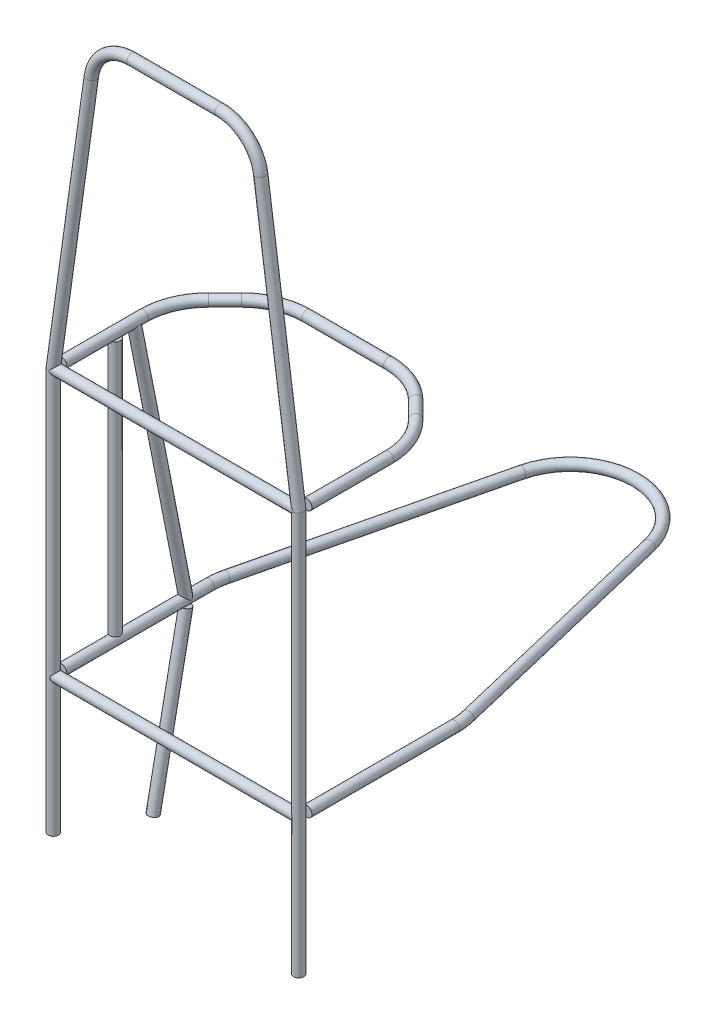
from build123d import *

# Parameters (mm, degrees)
SWEEP_1_PROFILE_R = 12.5
SWEEP_2_PROFILE_R = 12.5
SWEEP_4_PROFILE_R = 12.5
SWEEP_5_PROFILE_R = 12.5
SWEEP_6_PROFILE_R = 12.5
SWEEP_7_PROFILE_R = 12.5
SWEEP_8_PROFILE_R = 12.5
SWEEP_9_PROFILE_R = 12.5


with BuildPart() as part:
    # 扫描1: sweep along a path in 草图7
    with BuildLine(Plane(origin=(0, 0, 0), x_dir=(1, 0, 0), z_dir=(0, 1, 0))) as sweep_1_path:
        Line((-300, -380), (-300, -18.937247943))
        ThreePointArc((-300, -18.937247943), (-298.890953113, -0.131264349), (-295.579187264, 18.414010274))
        Line((-295.579187264, 18.414010274), (-155.579187264, 601.555978087))
        ThreePointArc((-155.579187264, 601.555978087), (0, 724.20471987), (155.579187264, 601.555978087))
        Line((155.579187264, 601.555978087), (295.579187264, 18.414010274))
        ThreePointArc((295.579187264, 18.414010274), (298.890953113, -0.131264349), (300, -18.937247943))
        Line((300, -18.937247943), (300, -380))
    # 扫描1 profile (on start of the path) → 扫描1 (sweep)
    with BuildSketch(Plane(origin=(-300, 0, 380), x_dir=(-1, 0, 0), z_dir=(0, 0, -1))):
        Circle(SWEEP_1_PROFILE_R)
    sweep(path=sweep_1_path.line)



with BuildPart() as body_2:
    # 扫描2: sweep along a path in 草图16
    with BuildLine(Plane(origin=(0, 650, 0), x_dir=(1, 0, 0), z_dir=(0, 1, 0))) as sweep_2_path:
        Line((-300, -380), (-300, -180))
        ThreePointArc((-300, -180), (-287.820725202, -118.770650822), (-253.13708499, -66.86291501))
        Line((-253.13708499, -66.86291501), (-213.13708499, -26.86291501))
        ThreePointArc((-213.13708499, -26.86291501), (-161.229349178, 7.820725202), (-100, 20))
        Line((-100, 20), (100, 20))
        ThreePointArc((100, 20), (161.229349178, 7.820725202), (213.13708499, -26.86291501))
        Line((213.13708499, -26.86291501), (253.13708499, -66.86291501))
        ThreePointArc((253.13708499, -66.86291501), (287.820725202, -118.770650822), (300, -180))
        Line((300, -180), (300, -380))
    # 扫描2 profile (on start of the path) → 扫描2 (sweep)
    with BuildSketch(Plane(origin=(-300, 650, 380), x_dir=(-1, 0, 0), z_dir=(0, 0, -1))):
        Circle(SWEEP_2_PROFILE_R)
    sweep(path=sweep_2_path.line)


with BuildPart() as part_1:
    add(part.part)

    add(body_2.part)  # 扫描4 merges body 2
    # 扫描4: sweep along a path in 草图62
    with BuildLine(Plane(origin=(-300, 0, 0), x_dir=(0, 0, -1), z_dir=(1, 0, 0))) as sweep_4_path:
        Line((-203.11294728, 648.324159638), (-75.515115371, 0))
    # 扫描4 profile (on start of the path) → 扫描4 (sweep)
    with BuildSketch(Plane(origin=(-300, 648.324159638, 203.11294728), x_dir=(0, 0.19310731812236004, -0.9811776412493254), z_dir=(0, -0.9811776412493254, -0.19310731812236004))):
        Circle(SWEEP_4_PROFILE_R)
    sweep(path=sweep_4_path.line)


with BuildPart() as body_2_2:
    # 扫描5: sweep along a path in 草图71
    with BuildLine(Plane.XY.offset(400)) as sweep_5_path:
        Line((-300, -334.084366165), (-300, 650))
        Line((-300, 650), (-206.993357902, 1313.874185482))
        ThreePointArc((-206.993357902, 1313.874185482), (-173.582833881, 1375.456671502), (-107.960499833, 1400))
        Line((-107.960499833, 1400), (107.960499833, 1400))
        ThreePointArc((107.960499833, 1400), (173.582833881, 1375.456671502), (206.993357902, 1313.874185482))
        Line((206.993357902, 1313.874185482), (300, 650))
        Line((300, 650), (300, -334.084366165))
    # 扫描5 profile (on start of the path) → 扫描5 (sweep)
    with BuildSketch(Plane(origin=(-300, -334.084366165, 400), x_dir=(0, 0, 1), z_dir=(0, 1, 0))):
        Circle(SWEEP_5_PROFILE_R)
    sweep(path=sweep_5_path.line, transition=Transition.RIGHT)

    # 扫描8: sweep along a path in 草图104
    with BuildLine(Plane.XY.offset(400)) as sweep_8_path:
        Line((-300, 650), (300, 650))
    # 扫描8 profile (on start of the path) → 扫描8 (sweep)
    with BuildSketch(Plane(origin=(-300, 650, 400), x_dir=(0, 0, 1), z_dir=(1, 0, 0))):
        Circle(SWEEP_8_PROFILE_R)
    sweep(path=sweep_8_path.line)

    # 扫描9: sweep along a path in 草图113
    with BuildLine(Plane.XY.offset(400)) as sweep_9_path:
        Line((-295.579187264, 0), (295.579187264, 0))
    # 扫描9 profile (on start of the path) → 扫描9 (sweep)
    with BuildSketch(Plane(origin=(-295.579187264, 0, 400), x_dir=(0, 0, 1), z_dir=(1, 0, 0))):
        Circle(SWEEP_9_PROFILE_R)
    sweep(path=sweep_9_path.line)


with BuildPart() as body_3:
    # 扫描6: sweep along a path in 草图72
    with BuildLine(Plane(origin=(-300, 0, 0), x_dir=(0, 0, -1), z_dir=(1, 0, 0))) as sweep_6_path:
        Line((-75.811380788, -15.844212764), (-156.10006168, -417.845852485))
    # 扫描6 profile (on start of the path) → 扫描6 (sweep)
    with BuildSketch(Plane(origin=(-300, -15.844212764, 75.811380788), x_dir=(0, -0.19585425400842235, -0.9806330155500601), z_dir=(0, -0.9806330155500601, 0.19585425400842235))):
        Circle(SWEEP_6_PROFILE_R)
    sweep(path=sweep_6_path.line)


with BuildPart() as body_4:
    # 扫描7: sweep along a path in 草图89
    with BuildLine(Plane(origin=(-300, 0, 0), x_dir=(0, 0, -1), z_dir=(1, 0, 0))) as sweep_7_path:
        Line((-248.769188656, 12.5), (-248.769188656, 637.5))
    # 扫描7 profile (on start of the path) → 扫描7 (sweep)
    with BuildSketch(Plane(origin=(-300, 12.5, 248.769188656), x_dir=(0, 0, 1), z_dir=(0, 1, 0))):
        Circle(SWEEP_7_PROFILE_R)
    sweep(path=sweep_7_path.line)


solid = Compound([part_1.part, body_2_2.part, body_3.part, body_4.part])
